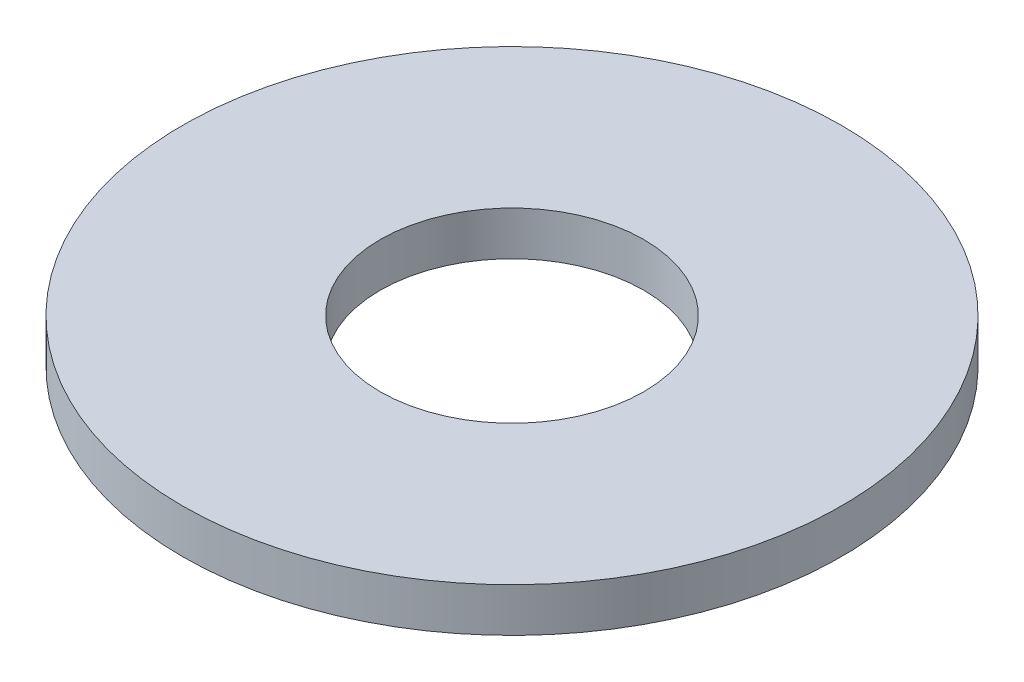
from build123d import *

# Parameters (mm, degrees)
ESBO_O1_R                = 7.5
ESBO_O1_R_2              = 3
RESSALTO_EXTRUS_O1_DEPTH = 1


with BuildPart() as part:
    # Esboço1 → Ressalto-extrusão1 (new body)
    with BuildSketch(Plane(origin=(0, 0, 0), x_dir=(1, 0, 0), z_dir=(0, 1, 0))):
        with Locations(Location((0, 0, 0), (0, 0, 270))):
            Circle(ESBO_O1_R)
        with Locations(Location((0, 0, 0), (0, 0, 270))):
            Circle(ESBO_O1_R_2, mode=Mode.SUBTRACT)
    extrude(amount=RESSALTO_EXTRUS_O1_DEPTH)


solid = part.part
